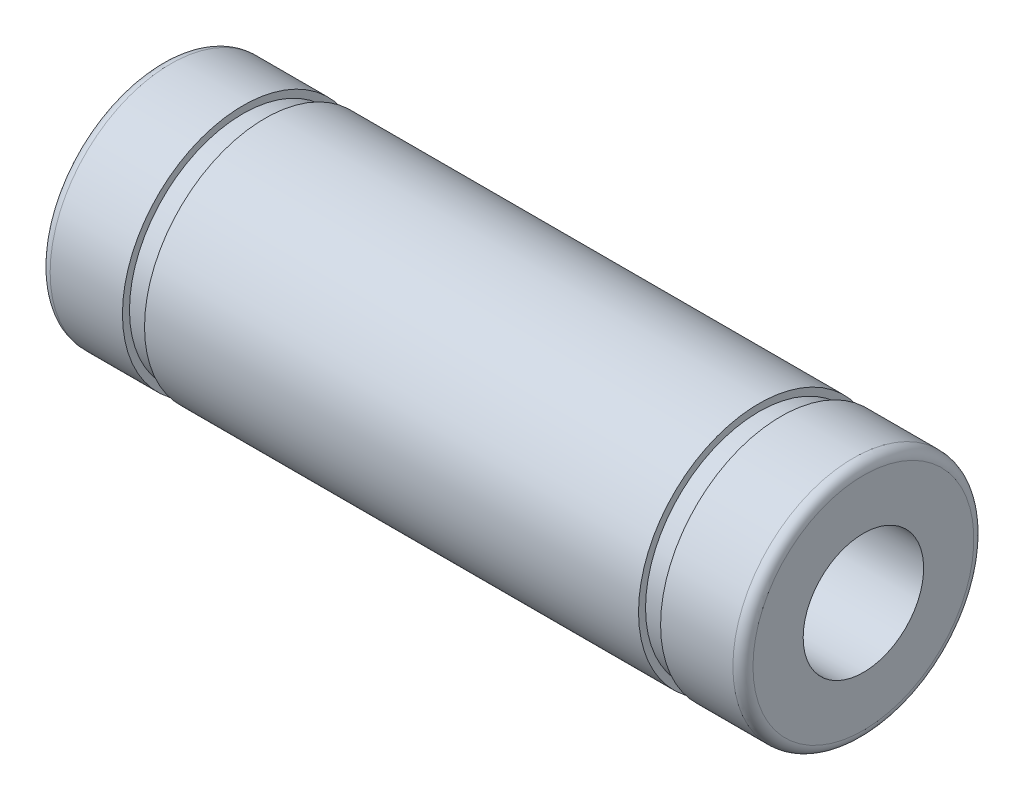
from build123d import *

# Parameters (mm, degrees)
FILLET1_R = 0.5


with BuildPart() as part:
    # Sketch2 → Revolve1 (revolve)
    with BuildSketch(Plane(origin=(0, 0, 0), x_dir=(1, 0, 0), z_dir=(0, 1, 0)), mode=Mode.PRIVATE) as revolve1_sk:
        Polygon((-12.3, 6), (12.3, 6), (12.3, 5.65), (13.4, 5.65), (13.4, 6), (17.5, 6), (17.5, 3), (-17.5, 3), (-17.5, 6), (-13.4, 6), (-13.4, 5.65), (-12.3, 5.65), align=None)
    revolve(revolve1_sk.sketch.rotate(Axis((0, 0, 0), (1, 0, 0)), 180), axis=Axis((0, 0, 0), (1, 0, 0)))

    # Fillet1
    fillet1_edges = [part.edges().sort_by_distance(p)[0] for p in [
        (-17.5, 0, -6),
        (17.5, 0, -6),
    ]]
    fillet(fillet1_edges, radius=FILLET1_R)


solid = part.part
